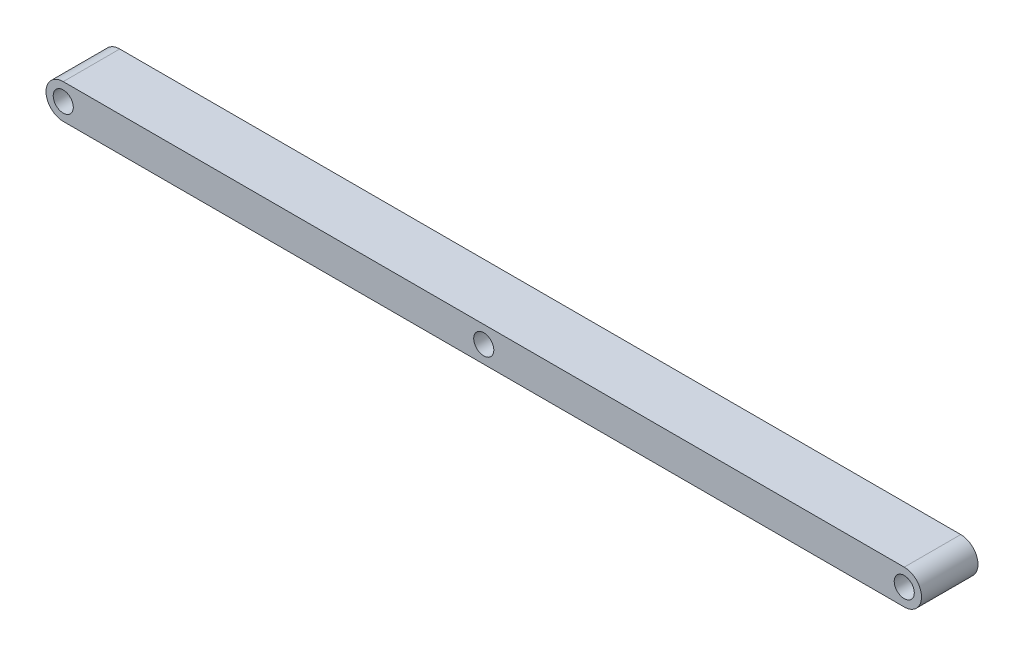
from build123d import *

# Parameters (mm, degrees)
SKETCH_1_R      = 1.6
EXTRUDE_1_DEPTH = 9


with BuildPart() as part:
    # 草圖1 → 填料-伸長1 (new body)
    with BuildSketch(Plane.XY):
        with BuildLine():
            Line((-41.926380368, 2.75), (92.073619632, 2.75))
            ThreePointArc((92.073619632, 2.75), (94.823619632, 0), (92.073619632, -2.75))
            Line((92.073619632, -2.75), (-41.926380368, -2.75))
            ThreePointArc((-41.926380368, -2.75), (-44.676380368, 0), (-41.926380368, 2.75))
        make_face()
        with Locations((92.073619632, 0)):
            Circle(SKETCH_1_R, mode=Mode.SUBTRACT)
        with Locations((-41.926380368, 0)):
            Circle(SKETCH_1_R, mode=Mode.SUBTRACT)
        with Locations((25.073619632, 0)):
            Circle(SKETCH_1_R, mode=Mode.SUBTRACT)
    extrude(amount=EXTRUDE_1_DEPTH)


solid = part.part
